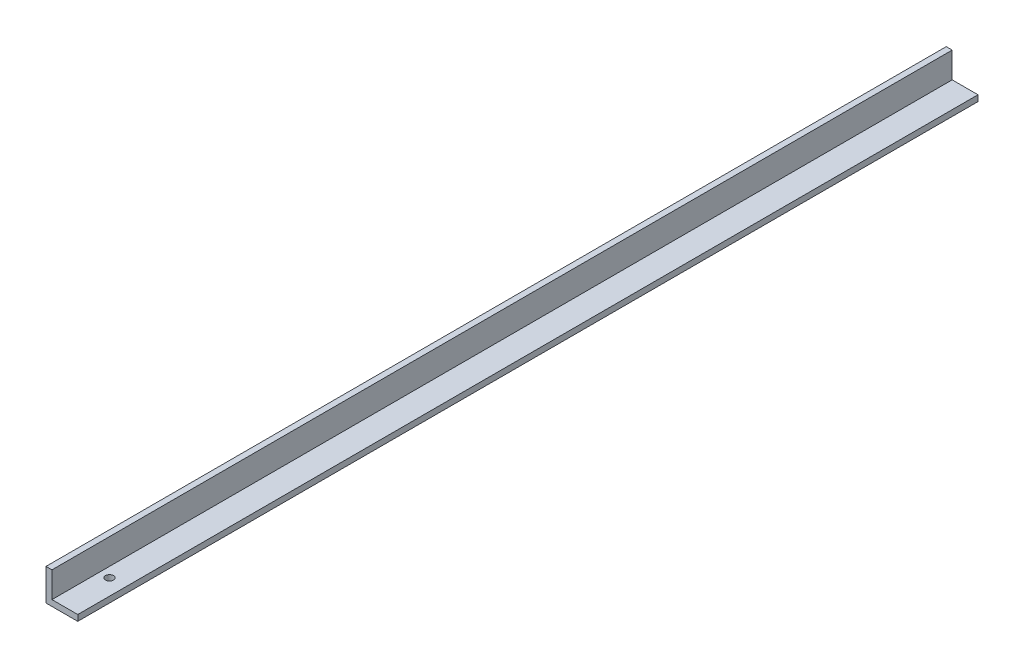
from build123d import *

# Parameters (mm, degrees)
BOSS_EXTRUDE1_DEPTH = 720.09
CUT_EXTRUDE1_REACH  = 722.681
SKETCH2_R           = 3.175


with BuildPart() as part:
    # Sketch1 → Boss-Extrude1 (new body)
    with BuildSketch(Plane.XY):
        Polygon((0, 0), (0, -20.6375), (20.6375, -20.6375), (20.6375, -25.4), (-4.7625, -25.4), (-4.7625, 0), align=None)
    extrude(amount=BOSS_EXTRUDE1_DEPTH)

    # Sketch2 → Cut-Extrude1 (cut, up to next)
    with BuildSketch(Plane(origin=(0, -20.6375, 0), x_dir=(1, 0, 0), z_dir=(0, 1, 0)), mode=Mode.PRIVATE) as cut_extrude1_sk1:
        with Locations(Location((7.9375, -681.99, 0), (0, 0, 270))):
            Circle(SKETCH2_R)
    cut_extrude1_tool1 = extrude(cut_extrude1_sk1.sketch, amount=-CUT_EXTRUDE1_REACH, mode=Mode.PRIVATE) & part.part
    add(cut_extrude1_tool1.solids().sort_by_distance((7.9375, -20.6375, 681.99))[0], mode=Mode.SUBTRACT)


solid = part.part
